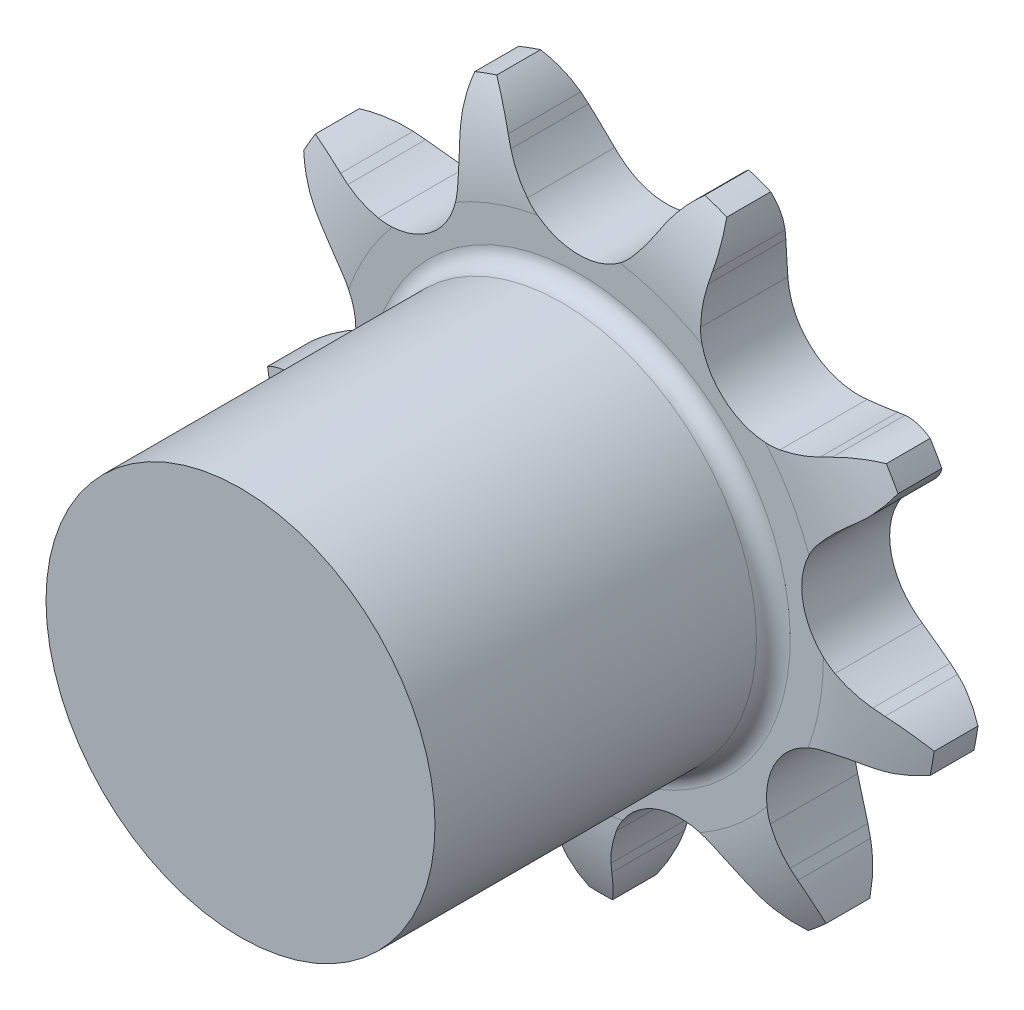
from build123d import *

# Parameters (mm, degrees)
CUT_EXTRUDE1_DEPTH      = 15.261517848
CIRPATTERN1_COUNT       = 9
BOSS_EXTRUDE1_START     = 1.3
SKETCH2_R               = 5.75
BOSS_EXTRUDE1_DEPTH     = 10
CUT_EXTRUDE3_DEPTH      = 19.090396139
CUT_EXTRUDE3_DEPTH_BACK = 19.090396139
SKETCH5_OUTSIDE_W       = 27.994
SKETCH5_OUTSIDE_H       = 27.696
SKETCH5_OUTSIDE_R       = 9.95
FILLET1_R               = 0.5


with BuildPart() as part:
    # Sketch1 → Revolve1 (revolve)
    with BuildSketch(Plane(origin=(0, 0, 0), x_dir=(0, 0, -1), z_dir=(1, 0, 0))):
        with BuildLine():
            Line((1.3, 0), (-1.3, 0))
            Line((-1.3, 0), (-1.3, 7.229960036))
            ThreePointArc((-1.3, 7.229960036), (-1.122370651, 8.679097711), (-0.6, 10.042432258))
            Line((-0.6, 10.042432258), (0.6, 10.042432258))
            ThreePointArc((0.6, 10.042432258), (1.122370651, 8.679097711), (1.3, 7.229960036))
            Line((1.3, 7.229960036), (1.3, 0))
        make_face()
    revolve(axis=Axis((0, 0, -1.3), (0, 0, 1)))

    # Sketch0 → Cut-Extrude1 (cut, symmetric)
    with BuildSketch(Plane.XY):
        with BuildLine():
            Line((5.098468609, -7.244145344), (4.862482466, -7.045348332))
            ThreePointArc((4.862482466, -7.045348332), (4.432831877, -6.719619585), (3.972029017, -6.439691789))
            ThreePointArc((3.972029017, -6.439691789), (2.299508544, -6.317847802), (1.096603336, -7.486261148))
            ThreePointArc((1.096603336, -7.486261148), (0.923541984, -7.996896649), (0.803784941, -8.522593421))
            Line((0.803784941, -8.522593421), (0.750793323, -8.826569736))
            ThreePointArc((0.750793323, -8.826569736), (-0.832851059, -11.14866988), (-3.623218265, -11.486204271))
            ThreePointArc((-3.623218265, -11.486204271), (4.11932842, -11.317761816), (10.158736006, -6.469983147))
            ThreePointArc((10.158736006, -6.469983147), (7.804227789, -8.005030268), (5.098468609, -7.244145344))
        make_face()
    cut_extrude1 = extrude(amount=CUT_EXTRUDE1_DEPTH, both=True, mode=Mode.SUBTRACT)

    # CirPattern1: Cut-Extrude1 ×9 about axis
    cirpattern1_axis = Axis((0, 0, 0), (0, 0, 1))
    for i in range(1, CIRPATTERN1_COUNT):
        add(cut_extrude1.rotate(cirpattern1_axis, i * 360 / CIRPATTERN1_COUNT), mode=Mode.SUBTRACT)

    # Sketch2 → Boss-Extrude1 (add)
    with BuildSketch(Plane.XY.offset(BOSS_EXTRUDE1_START)):
        with Locations(Location((0, 0, 0), (0, 0, 270))):
            Circle(SKETCH2_R)
    extrude(amount=BOSS_EXTRUDE1_DEPTH)

    # Sketch5 outside → Cut-Extrude3 (cut, two sides: drawn at the far end of the back side and taken through both)
    with BuildSketch(Plane.XY.offset(-CUT_EXTRUDE3_DEPTH_BACK)):
        with Locations((0, -0.255)):
            Rectangle(SKETCH5_OUTSIDE_W, SKETCH5_OUTSIDE_H)
        Circle(SKETCH5_OUTSIDE_R, mode=Mode.SUBTRACT)
    extrude(amount=CUT_EXTRUDE3_DEPTH + CUT_EXTRUDE3_DEPTH_BACK, mode=Mode.SUBTRACT)

    # Fillet1
    fillet1_edges = [part.edges().sort_by_distance(p)[0] for p in [
        (0, 5.75, 1.3),
    ]]
    fillet(fillet1_edges, radius=FILLET1_R)


solid = part.part
